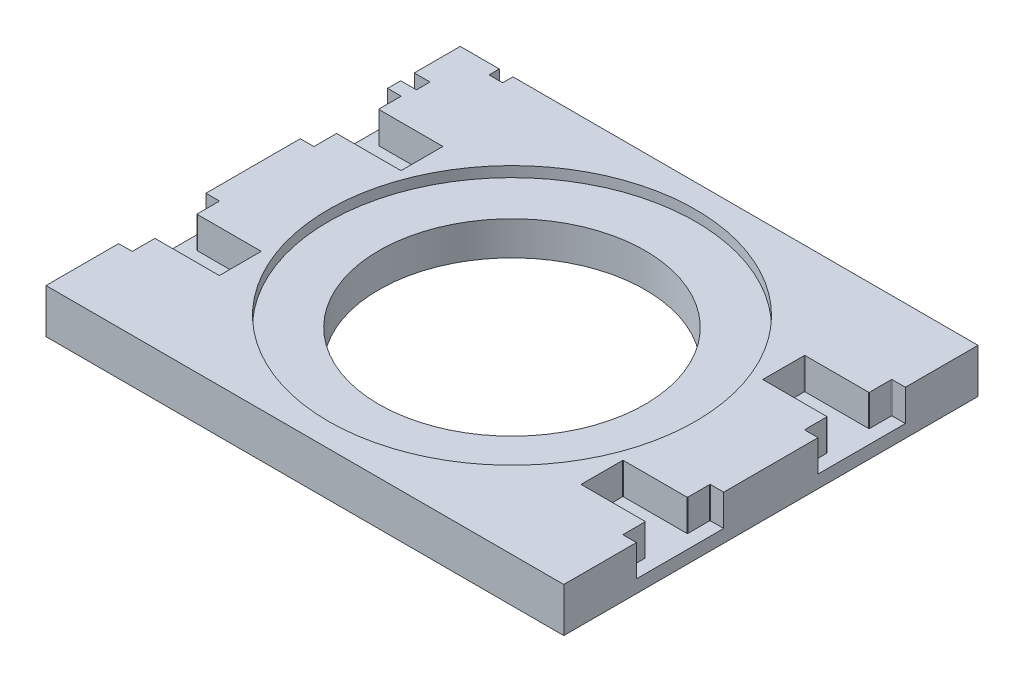
from build123d import *

# Parameters (mm, degrees)
BOSS_EXTRUDE1_DEPTH     = 21.463
SKETCH3_R               = 88.9
CUT_EXTRUDE1_DEPTH      = 5.0546
CUT_EXTRUDE2_DEPTH      = 162.442372526
CUT_EXTRUDE2_DEPTH_BACK = 162.442372526
SKETCH4_R               = 64.5033
SKETCH5_W               = 250.825
SKETCH5_H               = 200.66
BOSS_EXTRUDE2_DEPTH     = 6.223
CUT_EXTRUDE3_DEPTH      = 162.442372526
CUT_EXTRUDE3_DEPTH_BACK = 162.442372526
SKETCH4_2_R             = 64.5033
SKETCH6_W               = 6.604
SKETCH6_H               = 5.0038
SKETCH6_W_2             = 7.62
SKETCH6_H_2             = 6.604
CUT_EXTRUDE4_DEPTH      = 11.176
FILLET4_R               = 1.27


with BuildPart() as part:
    # Sketch2 → Boss-Extrude1 (new body)
    with BuildSketch(Plane(origin=(0, 0, 0), x_dir=(1, 0, 0), z_dir=(0, 1, 0))):
        with BuildLine():
            Line((-125.4125, 65.151), (-119.0752, 65.151))
            ThreePointArc((-119.0752, 65.151), (-118.895594878, 65.076605122), (-118.8212, 64.897))
            Line((-118.8212, 64.897), (-118.8212, 54.4195))
            ThreePointArc((-118.8212, 54.4195), (-118.746805122, 54.239894878), (-118.5672, 54.1655))
            Line((-118.5672, 54.1655), (-87.8713, 54.1655))
            ThreePointArc((-87.8713, 54.1655), (-87.691694878, 54.091105122), (-87.6173, 53.9115))
            Line((-87.6173, 53.9115), (-87.6173, 34.0995))
            ThreePointArc((-87.6173, 34.0995), (-87.691694878, 33.919894878), (-87.8713, 33.8455))
            Line((-87.8713, 33.8455), (-118.5672, 33.8455))
            ThreePointArc((-118.5672, 33.8455), (-118.746805122, 33.771105122), (-118.8212, 33.5915))
            Line((-118.8212, 33.5915), (-118.8212, 23.114))
            ThreePointArc((-118.8212, 23.114), (-118.895594878, 22.934394878), (-119.0752, 22.86))
            Line((-119.0752, 22.86), (-125.4125, 22.86))
            Line((-125.4125, 22.86), (-125.4125, -22.86))
            Line((-125.4125, -22.86), (-119.0752, -22.86))
            ThreePointArc((-119.0752, -22.86), (-118.895594878, -22.934394878), (-118.8212, -23.114))
            Line((-118.8212, -23.114), (-118.8212, -33.5915))
            ThreePointArc((-118.8212, -33.5915), (-118.746805122, -33.771105122), (-118.5672, -33.8455))
            Line((-118.5672, -33.8455), (-87.8713, -33.8455))
            ThreePointArc((-87.8713, -33.8455), (-87.691694878, -33.919894878), (-87.6173, -34.0995))
            Line((-87.6173, -34.0995), (-87.6173, -53.9115))
            ThreePointArc((-87.6173, -53.9115), (-87.691694878, -54.091105122), (-87.8713, -54.1655))
            Line((-87.8713, -54.1655), (-118.5672, -54.1655))
            ThreePointArc((-118.5672, -54.1655), (-118.746805122, -54.239894878), (-118.8212, -54.4195))
            Line((-118.8212, -54.4195), (-118.8212, -64.897))
            ThreePointArc((-118.8212, -64.897), (-118.895594878, -65.076605122), (-119.0752, -65.151))
            Line((-119.0752, -65.151), (-125.4125, -65.151))
            Line((-125.4125, -65.151), (-125.4125, -100.33))
            Line((-125.4125, -100.33), (125.4125, -100.33))
            Line((125.4125, -100.33), (125.4125, -65.151))
            Line((125.4125, -65.151), (119.0752, -65.151))
            ThreePointArc((119.0752, -65.151), (118.895594878, -65.076605122), (118.8212, -64.897))
            Line((118.8212, -64.897), (118.8212, -54.4195))
            ThreePointArc((118.8212, -54.4195), (118.746805122, -54.239894878), (118.5672, -54.1655))
            Line((118.5672, -54.1655), (87.8713, -54.1655))
            ThreePointArc((87.8713, -54.1655), (87.691694878, -54.091105122), (87.6173, -53.9115))
            Line((87.6173, -53.9115), (87.6173, -34.0995))
            ThreePointArc((87.6173, -34.0995), (87.691694878, -33.919894878), (87.8713, -33.8455))
            Line((87.8713, -33.8455), (118.5672, -33.8455))
            ThreePointArc((118.5672, -33.8455), (118.746805122, -33.771105122), (118.8212, -33.5915))
            Line((118.8212, -33.5915), (118.8212, -23.114))
            ThreePointArc((118.8212, -23.114), (118.895594878, -22.934394878), (119.0752, -22.86))
            Line((119.0752, -22.86), (125.4125, -22.86))
            Line((125.4125, -22.86), (125.4125, 22.86))
            Line((125.4125, 22.86), (119.0752, 22.86))
            ThreePointArc((119.0752, 22.86), (118.895594878, 22.934394878), (118.8212, 23.114))
            Line((118.8212, 23.114), (118.8212, 33.5915))
            ThreePointArc((118.8212, 33.5915), (118.746805122, 33.771105122), (118.5672, 33.8455))
            Line((118.5672, 33.8455), (87.8713, 33.8455))
            ThreePointArc((87.8713, 33.8455), (87.691694878, 33.919894878), (87.6173, 34.0995))
            Line((87.6173, 34.0995), (87.6173, 53.9115))
            ThreePointArc((87.6173, 53.9115), (87.691694878, 54.091105122), (87.8713, 54.1655))
            Line((87.8713, 54.1655), (118.5672, 54.1655))
            ThreePointArc((118.5672, 54.1655), (118.746805122, 54.239894878), (118.8212, 54.4195))
            Line((118.8212, 54.4195), (118.8212, 64.897))
            ThreePointArc((118.8212, 64.897), (118.895594878, 65.076605122), (119.0752, 65.151))
            Line((119.0752, 65.151), (125.4125, 65.151))
            Line((125.4125, 65.151), (125.4125, 100.33))
            Line((125.4125, 100.33), (-125.4125, 100.33))
            Line((-125.4125, 100.33), (-125.4125, 65.151))
        make_face()
    extrude(amount=BOSS_EXTRUDE1_DEPTH)

    # Sketch3 → Cut-Extrude1 (cut)
    with BuildSketch(Plane(origin=(0, 21.463, 0), x_dir=(1, 0, 0), z_dir=(0, 1, 0))):
        Circle(SKETCH3_R)
    extrude(amount=-CUT_EXTRUDE1_DEPTH, mode=Mode.SUBTRACT)

    # Sketch4 → Cut-Extrude2 (cut, two sides: drawn at the far end of the back side and taken through both)
    with BuildSketch(Plane(origin=(0, 16.4084, 0), x_dir=(1, 0, 0), z_dir=(0, 1, 0)).offset(-CUT_EXTRUDE2_DEPTH_BACK)):
        Circle(SKETCH4_R)
    extrude(amount=CUT_EXTRUDE2_DEPTH + CUT_EXTRUDE2_DEPTH_BACK, mode=Mode.SUBTRACT)

    # Sketch5 → Boss-Extrude2 (add)
    with BuildSketch(Plane.XZ):
        Rectangle(SKETCH5_W, SKETCH5_H)
    extrude(amount=-BOSS_EXTRUDE2_DEPTH)

    # Sketch4<2> → Cut-Extrude3 (cut, two sides: drawn at the far end of the back side and taken through both)
    with BuildSketch(Plane(origin=(0, 16.4084, 0), x_dir=(1, 0, 0), z_dir=(0, 1, 0)).offset(-CUT_EXTRUDE3_DEPTH_BACK)):
        Circle(SKETCH4_2_R)
    extrude(amount=CUT_EXTRUDE3_DEPTH + CUT_EXTRUDE3_DEPTH_BACK, mode=Mode.SUBTRACT)

    # Sketch6 → Cut-Extrude4 (cut)
    with BuildSketch(Plane(origin=(0, 21.463, 0), x_dir=(1, 0, 0), z_dir=(0, 1, 0))):
        with Locations((-103.1621, 97.8281)):
            Rectangle(SKETCH6_W, SKETCH6_H)
        with Locations((-121.6025, 74.7776)):
            Rectangle(SKETCH6_W_2, SKETCH6_H_2)
    extrude(amount=-CUT_EXTRUDE4_DEPTH, mode=Mode.SUBTRACT)

    # Fillet4
    fillet4_edges = [part.edges().sort_by_distance(p)[0] for p in [
        (-121.6025, 10.287, -78.0796),
        (-121.6025, 10.287, -71.4756),
        (-99.8601, 10.287, -97.8281),
        (-106.4641, 10.287, -97.8281),
    ]]
    fillet(fillet4_edges, radius=FILLET4_R)


solid = part.part
